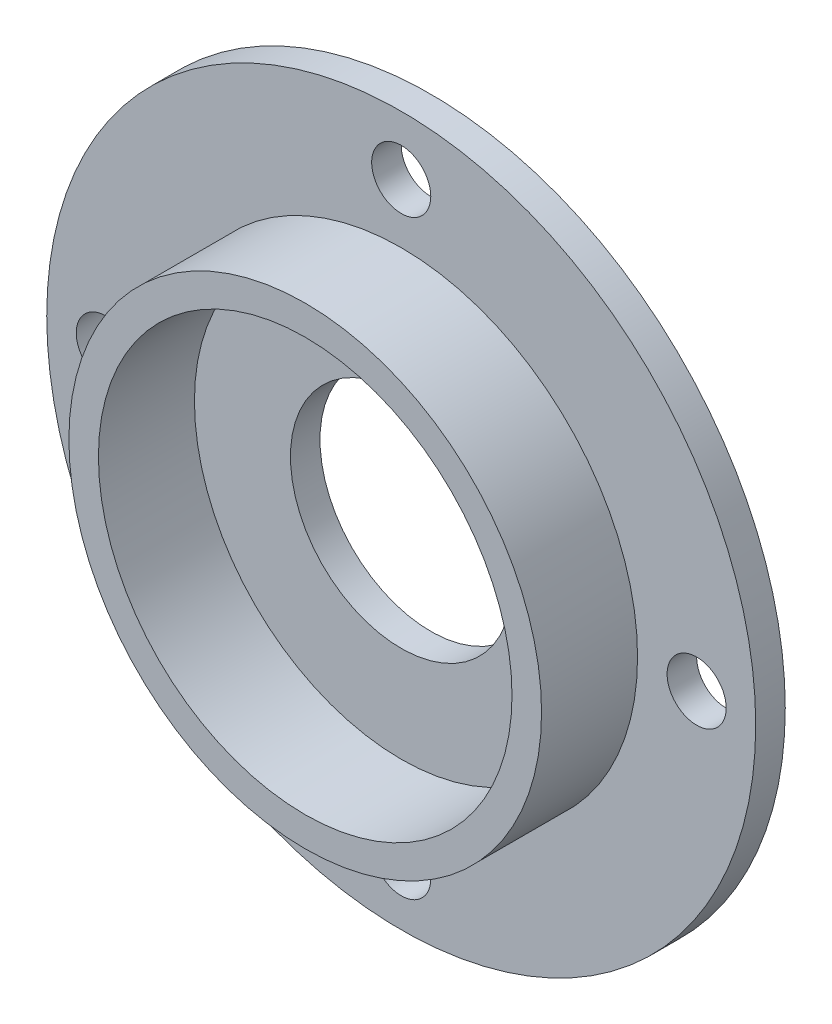
from build123d import *

# Parameters (mm, degrees)
SKETCH_1_R      = 120
SKETCH_1_R_2    = 37.5
SKETCH_1_R_3    = 10
EXTRUDE_1_DEPTH = 10
SKETCH_2_R      = 80
SKETCH_2_R_2    = 70
EXTRUDE_2_DEPTH = 32.5


with BuildPart() as part:
    # 草图1 → 拉伸1 (new body)
    with BuildSketch(Plane.XY):
        Circle(SKETCH_1_R)
        Circle(SKETCH_1_R_2, mode=Mode.SUBTRACT)
        with Locations((0, 100)):
            Circle(SKETCH_1_R_3, mode=Mode.SUBTRACT)
        with Locations((100, 0)):
            Circle(SKETCH_1_R_3, mode=Mode.SUBTRACT)
        with Locations((0, -100)):
            Circle(SKETCH_1_R_3, mode=Mode.SUBTRACT)
        with Locations((-100, 0)):
            Circle(SKETCH_1_R_3, mode=Mode.SUBTRACT)
    extrude(amount=EXTRUDE_1_DEPTH)

    # 草图2 → 拉伸2 (add)
    with BuildSketch(Plane.XY.offset(10)):
        Circle(SKETCH_2_R)
        Circle(SKETCH_2_R_2, mode=Mode.SUBTRACT)
    extrude(amount=EXTRUDE_2_DEPTH)


solid = part.part
